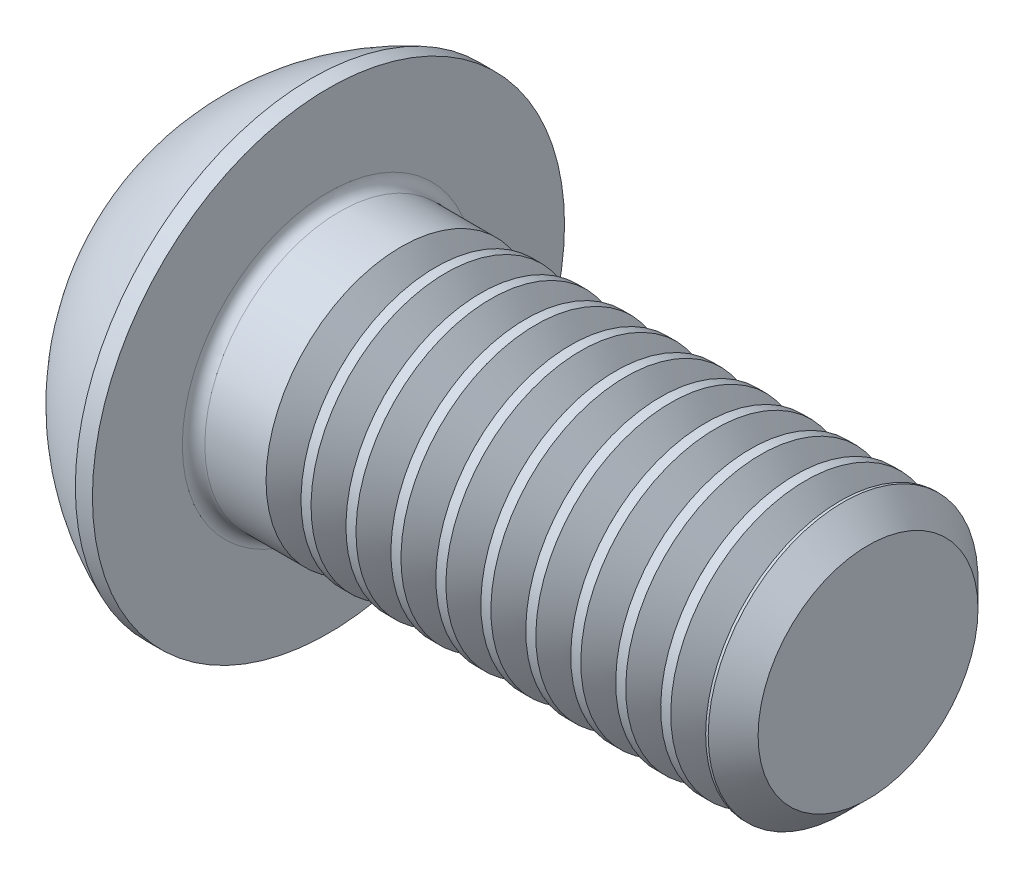
from build123d import *

# Parameters (mm, degrees)
FILLET1_R       = 0.25
HEX_2_DEPTH     = 2.08
THDSCHPAT_COUNT = 10
THDSCHPAT_PITCH = 1


with BuildPart() as part:
    # BodySke → BaseBody (revolve)
    with BuildSketch(Plane.XY, mode=Mode.PRIVATE) as basebody_sk:
        with BuildLine():
            Line((15.3, 0), (15.3, 2.4455))
            Line((15.3, 2.4455), (14.7455, 3))
            Line((14.7455, 3), (3.3, 3))
            Line((3.3, 3), (3.3, 5.25))
            Line((3.3, 5.25), (2.92, 5.25))
            ThreePointArc((2.92, 5.25), (1.224500646, 4.199464996), (0, 2.625))
            Line((0, 2.625), (0, 0))
            Line((0, 0), (15.3, 0))
        make_face()
    revolve(basebody_sk.sketch.rotate(Axis((0, 0, 0), (1, 0, 0)), 90), axis=Axis((0, 0, 0), (1, 0, 0)))

    # Fillet1
    fillet1_edges = [part.edges().sort_by_distance(p)[0] for p in [
        (3.3, 0, -3),
    ]]
    fillet(fillet1_edges, radius=FILLET1_R)

    # Sketch2 → PreBroach (revolve, cut)
    with BuildSketch(Plane.XY, mode=Mode.PRIVATE) as prebroach_sk:
        Polygon((0, 2), (2.08, 2), (3.234700538, 0), (0, 0), align=None)
    revolve(prebroach_sk.sketch.rotate(Axis((0, 0, 0), (1, 0, 0)), 90), axis=Axis((0, 0, 0), (1, 0, 0)), mode=Mode.SUBTRACT)

    # Sketch3 → Hex 2 (cut)
    with BuildSketch(Plane(origin=(0, 0, 0), x_dir=(0, 0, -1), z_dir=(1, 0, 0))):
        Polygon((-2, -1.154700538), (-2, 1.154700538), (0, 2.309401077), (2, 1.154700538), (2, -1.154700538), (0, -2.309401077), align=None)
    extrude(amount=HEX_2_DEPTH, mode=Mode.SUBTRACT)

    # ThdSchSke → ThreadSchematic (revolve, cut)
    with BuildSketch(Plane.XY, mode=Mode.PRIVATE) as threadschematic_sk:
        Polygon((5.3, -2.4455), (4.91173492, -3), (4.91173492, -3.75), (5.68826508, -3.75), (5.68826508, -3), align=None)
    threadschematic = revolve(threadschematic_sk.sketch.rotate(Axis((-3.175, 0, 0), (1, 0, 0)), 270), axis=Axis((-3.175, 0, 0), (1, 0, 0)), mode=Mode.SUBTRACT)

    # ThdSchPat: ThreadSchematic ×10
    with Locations(*[(i * THDSCHPAT_PITCH, 0, 0) for i in range(1, THDSCHPAT_COUNT)]):
        add(threadschematic, mode=Mode.SUBTRACT)


solid = part.part
